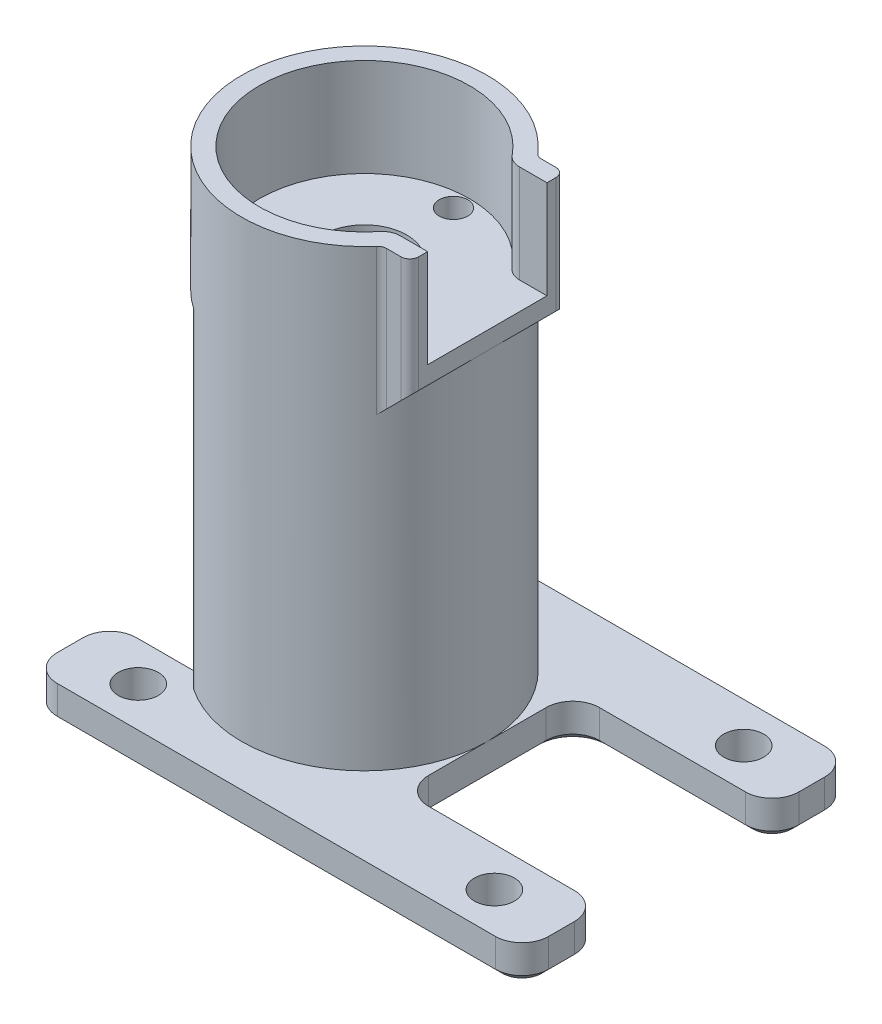
from build123d import *

# Parameters (mm, degrees)
SKETCH5_R                = 13.8
BOSS_EXTRUDE10_DEPTH     = 55
BOSS_EXTRUDE13_DEPTH     = 13
SKETCH7_W                = 55.2
SKETCH7_H                = 37
BOSS_EXTRUDE11_DEPTH     = 4
SKETCH14_R               = 9.6
CUT_EXTRUDE9_DEPTH       = 53.773193953
FILLET1_R                = 1
FILLET3_R                = 3
CUT_EXTRUDE11_DEPTH      = 65.257373118
CUT_EXTRUDE11_DEPTH_BACK = 65.257373118
SKETCH2_R                = 2.25
CUT_EXTRUDE12_DEPTH      = 11
CHAMFER1_SIZE            = 0.8
FILLET7_R                = 1
SKETCH16_R               = 4.75
CUT_EXTRUDE13_DEPTH      = 56.136285693
SKETCH17_R               = 1.6
CUT_EXTRUDE14_DEPTH      = 3
FILLET8_R                = 2
DRAFT1_ANGLE             = 45


with BuildPart() as part:
    # Sketch5 → Boss-Extrude10 (new body)
    with BuildSketch(Plane(origin=(0, 55, 0), x_dir=(1, 0, 0), z_dir=(0, 1, 0))):
        with Locations((-8.6, 0)):
            Circle(SKETCH5_R)
    extrude(amount=-BOSS_EXTRUDE10_DEPTH)

    # Sketch5<9> → Boss-Extrude13 (add)
    with BuildSketch(Plane(origin=(0, 55, 0), x_dir=(1, 0, 0), z_dir=(0, 1, 0))):
        with BuildLine():
            Line((5.2, -8.7), (5.2, 8.4e-08))
            ThreePointArc((5.2, 8.4e-08), (4.405144544, -4.615865618), (2.112142643, -8.7))
            Line((2.112142643, -8.7), (5.2, -8.7))
        make_face()
        with BuildLine():
            Line((5.2, 8.4e-08), (5.2, 8.7))
            Line((5.2, 8.7), (2.112142643, 8.7))
            ThreePointArc((2.112142643, 8.7), (4.405144516, 4.615865697), (5.2, 8.4e-08))
        make_face()
    extrude(amount=-BOSS_EXTRUDE13_DEPTH)

    # Sketch7 → Boss-Extrude11 (add)
    with BuildSketch(Plane(origin=(0, 0, 0), x_dir=(1, 0, 0), z_dir=(0, 1, 0))):
        Rectangle(SKETCH7_W, SKETCH7_H)
    extrude(amount=BOSS_EXTRUDE11_DEPTH)

    # Sketch14 → Cut-Extrude9 (cut, through all)
    with BuildSketch(Plane(origin=(0, 41, 0), x_dir=(1, 0, 0), z_dir=(0, 1, 0))):
        with BuildLine():
            Line((-28.6, -9.6), (-8.6, -9.6))
            ThreePointArc((-8.6, -9.6), (-18.2, 0), (-8.6, 9.6))
            Line((-8.6, 9.6), (-28.6, 9.6))
            Line((-28.6, 9.6), (-28.6, -9.6))
        make_face()
        with Locations((-8.6, 0)):
            Circle(SKETCH14_R)
        Polygon((5.2, -9.6), (27.6, -9.6), (27.6, 9.6), (5.2, 9.6), (5.2, 0), align=None)
    extrude(amount=-CUT_EXTRUDE9_DEPTH, mode=Mode.SUBTRACT)

    # Fillet1
    fillet1_edges = [part.edges().sort_by_distance(p)[0] for p in [
        (-18.513626985, 22.5, -9.6),
        (-18.513626985, 22.5, 9.6),
    ]]
    fillet(fillet1_edges, radius=FILLET1_R)

    # Fillet3
    fillet3_edges = [part.edges().sort_by_distance(p)[0] for p in [
        (27.6, 2, -18.5),
        (-27.6, 2, -18.5),
        (-27.6, 2, 18.5),
        (27.6, 2, 18.5),
        (-27.6, 2, -9.6),
        (-27.6, 2, 9.6),
        (5.2, 2, 9.6),
        (5.2, 2, -9.6),
        (27.6, 2, -9.6),
        (27.6, 2, 9.6),
    ]]
    fillet(fillet3_edges, radius=FILLET3_R)

    # Sketch2 → Cut-Extrude11 (cut, two sides: drawn at the far end of the back side and taken through both)
    with BuildSketch(Plane(origin=(0, 0, 0), x_dir=(1, 0, 0), z_dir=(0, 1, 0)).offset(-CUT_EXTRUDE11_DEPTH_BACK)):
        with Locations(Location((-20, 14, 0), (0, 0, 270))):
            Circle(SKETCH2_R)
        with Locations(Location((20, 14, 0), (0, 0, 270))):
            Circle(SKETCH2_R)
        with Locations(Location((20, -14, 0), (0, 0, 270))):
            Circle(SKETCH2_R)
        with Locations(Location((-20, -14, 0), (0, 0, 270))):
            Circle(SKETCH2_R)
    extrude(amount=CUT_EXTRUDE11_DEPTH + CUT_EXTRUDE11_DEPTH_BACK, mode=Mode.SUBTRACT)

    # Sketch15 → Cut-Extrude12 (cut)
    with BuildSketch(Plane(origin=(0, 55, 0), x_dir=(1, 0, 0), z_dir=(0, 1, 0))):
        with BuildLine():
            Line((4.1, -6.7), (5.2, -6.7))
            Line((5.2, -6.7), (5.2, 6.7))
            Line((5.2, 6.7), (4.1, 6.7))
            Line((4.1, 6.7), (1.113392816, 6.7))
            ThreePointArc((1.113392816, 6.7), (-20.4, 0), (1.113392816, -6.7))
            Line((1.113392816, -6.7), (4.1, -6.7))
        make_face()
    extrude(amount=-CUT_EXTRUDE12_DEPTH, mode=Mode.SUBTRACT)

    # Chamfer1
    chamfer1_edges = [part.edges().sort_by_distance(p)[0] for p in [
        (16.4, 0, -9.6),
        (27.6, 0, -14.05),
        (-27.6, 0, -14.05),
        (0, 0, -18.5),
        (5.2, 0, 0),
        (16.4, 0, 9.6),
        (27.6, 0, 14.05),
        (0, 0, 18.5),
        (-27.6, 0, 14.05),
        (-26.721320344, 0, 17.621320344),
        (26.721320344, 0, 17.621320344),
        (26.721320344, 0, -17.621320344),
        (-26.721320344, 0, -17.621320344),
        (-26.721320344, 0, -10.478679656),
        (-26.721320344, 0, 10.478679656),
        (26.721320344, 0, 10.478679656),
        (26.721320344, 0, -10.478679656),
        (6.078679656, 0, -8.721320344),
        (6.078679656, 0, 8.721320344),
        (-16.6, 0, 9.6),
        (-16.6, 0, -9.6),
        (1, 0, 0),
    ]]
    chamfer(chamfer1_edges, length=CHAMFER1_SIZE)

    # Fillet7
    fillet7_edges = [part.edges().sort_by_distance(p)[0] for p in [
        (5.2, 48.5, 8.7),
        (2.112142643, 48.5, 8.7),
        (2.112142643, 48.5, -8.7),
        (5.2, 48.5, -8.7),
    ]]
    fillet(fillet7_edges, radius=FILLET7_R)

    # Sketch16 → Cut-Extrude13 (cut, through all)
    with BuildSketch(Plane(origin=(0, 44, 0), x_dir=(1, 0, 0), z_dir=(0, 1, 0))):
        with Locations(Location((-8.6, 0, 0), (0, 0, 270))):
            Circle(SKETCH16_R)
    extrude(amount=-CUT_EXTRUDE13_DEPTH, mode=Mode.SUBTRACT)

    # Sketch17 → Cut-Extrude14 (cut)
    with BuildSketch(Plane(origin=(0, 44, 0), x_dir=(1, 0, 0), z_dir=(0, 1, 0))):
        with Locations(Location((-8.6, 10, 0), (0, 0, 270))):
            Circle(SKETCH17_R)
    extrude(amount=-CUT_EXTRUDE14_DEPTH, mode=Mode.SUBTRACT)

    # Fillet8
    fillet8_edges = [part.edges().sort_by_distance(p)[0] for p in [
        (1.113392816, 49.5, -6.7),
        (1.113392816, 49.5, 6.7),
    ]]
    fillet(fillet8_edges, radius=FILLET8_R)

    # Draft1
    draft1_faces = [part.faces().sort_by_distance(p)[0] for p in [
        (4.269454108, 42, -6.535437948),
        (4.269454108, 42, 6.535437948),
    ]]
    draft(draft1_faces, Plane(origin=(5.2, 42, 0), x_dir=(0, 0, 1), z_dir=(1, 0, 0)), DRAFT1_ANGLE)


solid = part.part
